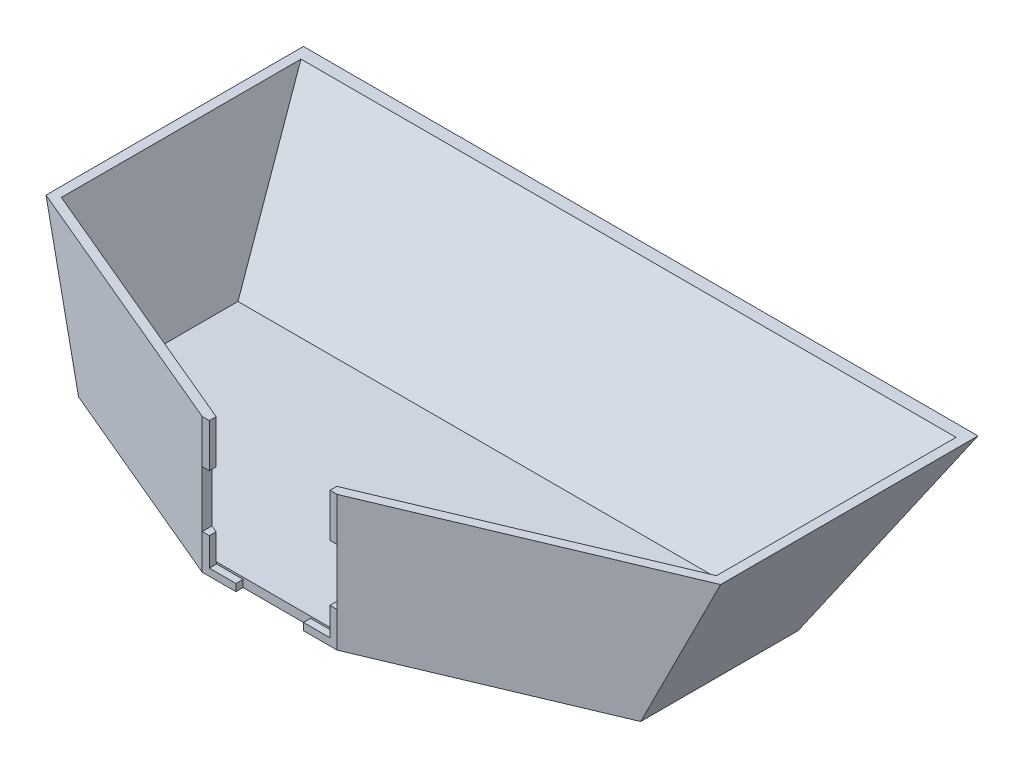
from build123d import *

# Parameters (mm, degrees)
SHELL2_T           = -4
CUT_EXTRUDE1_DEPTH = 3.175
SKETCH6_W          = 2.767139064
SKETCH6_H          = 25
CUT_EXTRUDE2_DEPTH = 10


with BuildPart() as part:
    # Sketch2 → Loft2 section 0
    with BuildSketch(Plane(origin=(0, 60, 0), x_dir=(1, 0, 0), z_dir=(0, 1, 0))):
        with BuildLine():
            Line((-150, -24.473684211), (-150, 90))
            Line((-150, 90), (150, 90))
            Line((150, 90), (150, -24.473684211))
            Line((150, -24.473684211), (30, -75))
            Line((30, -75), (-30, -75))
            Line((-30, -75), (-150, -24.473684211))
        make_face()
    # Sketch1 → Loft2 section 1
    with BuildSketch(Plane(origin=(0, 0, 0), x_dir=(1, 0, 0), z_dir=(0, 1, 0))):
        with BuildLine():
            Line((125, -35), (125, 35))
            Line((125, 35), (-125, 35))
            Line((-125, 35), (-125, -35))
            Line((-125, -35), (-30, -75))
            Line((-30, -75), (30, -75))
            Line((30, -75), (125, -35))
        make_face()
    loft()

    # Shell2
    shell2_openings = [part.faces().sort_by_distance(p)[0] for p in [
        (0, 60, -16.664896975),
        (0, 30, 75),
    ]]
    offset(amount=SHELL2_T, openings=shell2_openings, kind=Kind.INTERSECTION)

    # Sketch5 → Cut-Extrude1 (cut)
    with BuildSketch(Plane.XY.offset(75)):
        Polygon((-26.825, 3.175), (-15, 3.175), (-15, 0), (15, 0), (15, 3.175), (26.825, 3.175), (26.825, 15.675), (30, 15.675), (30, 40.675), (26.825, 40.675), (26.825, 60), (-26.825, 60), (-26.825, 40.675), (-30, 40.675), (-30, 15.675), (-26.825, 15.675), align=None)
    extrude(amount=-CUT_EXTRUDE1_DEPTH, mode=Mode.SUBTRACT)

    # Sketch6 → Cut-Extrude2 (cut)
    with BuildSketch(Plane.XY.offset(71.825)):
        with Locations((-28.616430468, 28.175)):
            Rectangle(SKETCH6_W, SKETCH6_H)
        with Locations((28.616430468, 28.175)):
            Rectangle(SKETCH6_W, SKETCH6_H)
    extrude(amount=-CUT_EXTRUDE2_DEPTH, mode=Mode.SUBTRACT)


solid = part.part
